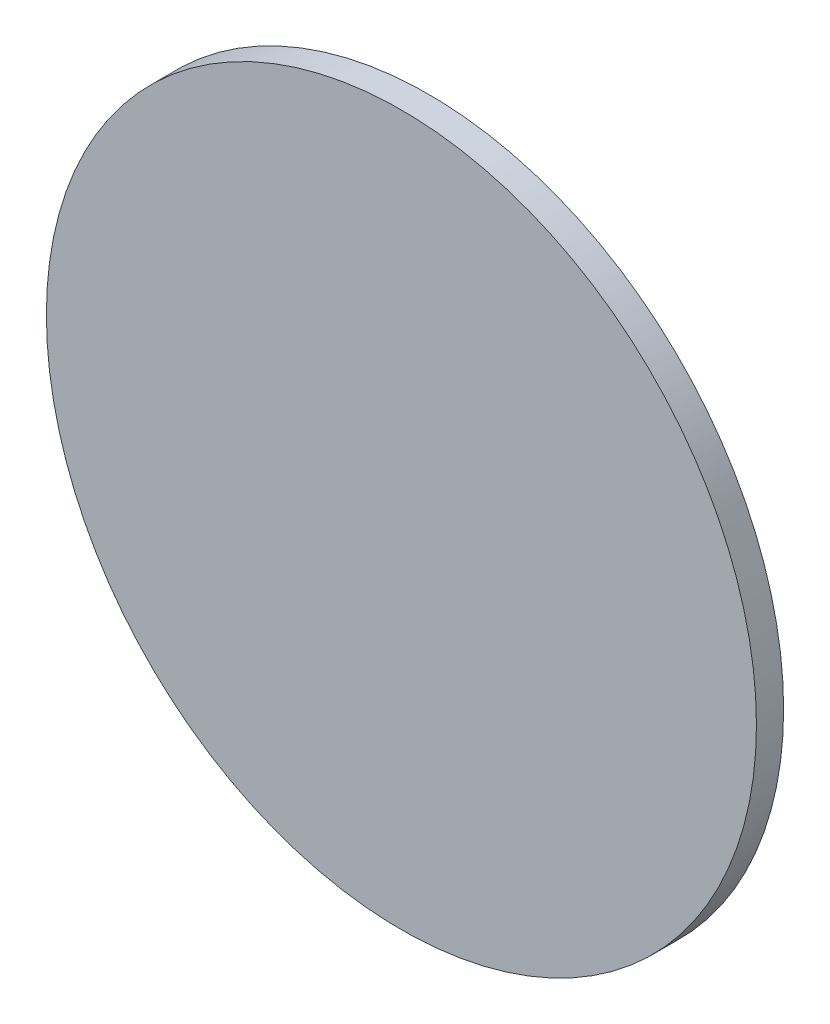
from build123d import *

# Parameters (mm, degrees)
SKETCH_1_R      = 20.9
EXTRUDE_1_DEPTH = 1.6


with BuildPart() as part:
    # Эскиз1 → Бобышка-Вытянуть1 (new body)
    with BuildSketch(Plane.XY):
        Circle(SKETCH_1_R)
    extrude(amount=EXTRUDE_1_DEPTH)


solid = part.part
